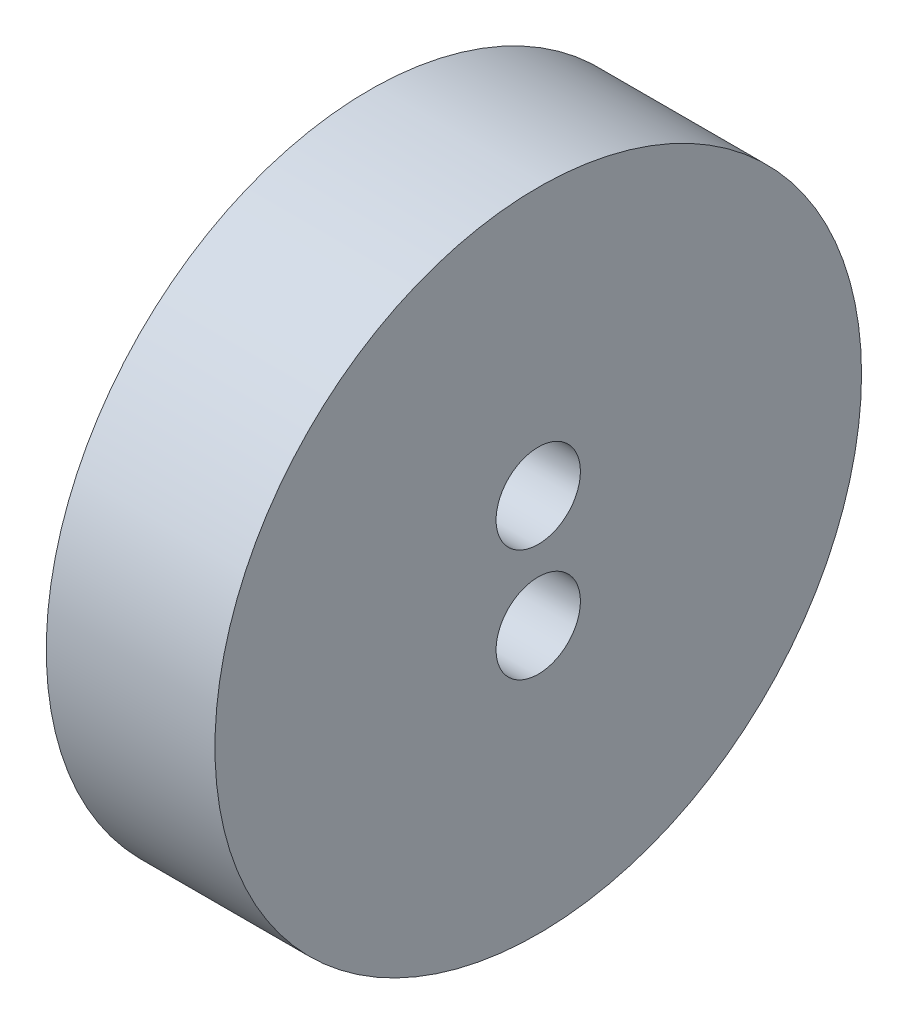
from build123d import *

# Parameters (mm, degrees)
SKETCH1_R           = 11.5
SKETCH1_R_2         = 1.5
BOSS_EXTRUDE1_DEPTH = 6


with BuildPart() as part:
    # Sketch1 → Boss-Extrude1 (new body)
    with BuildSketch(Plane(origin=(0, 0, 0), x_dir=(0, 0, -1), z_dir=(1, 0, 0))):
        Circle(SKETCH1_R)
        with Locations((0, 2)):
            Circle(SKETCH1_R_2, mode=Mode.SUBTRACT)
        with Locations((0, -2)):
            Circle(SKETCH1_R_2, mode=Mode.SUBTRACT)
    extrude(amount=BOSS_EXTRUDE1_DEPTH)


solid = part.part
